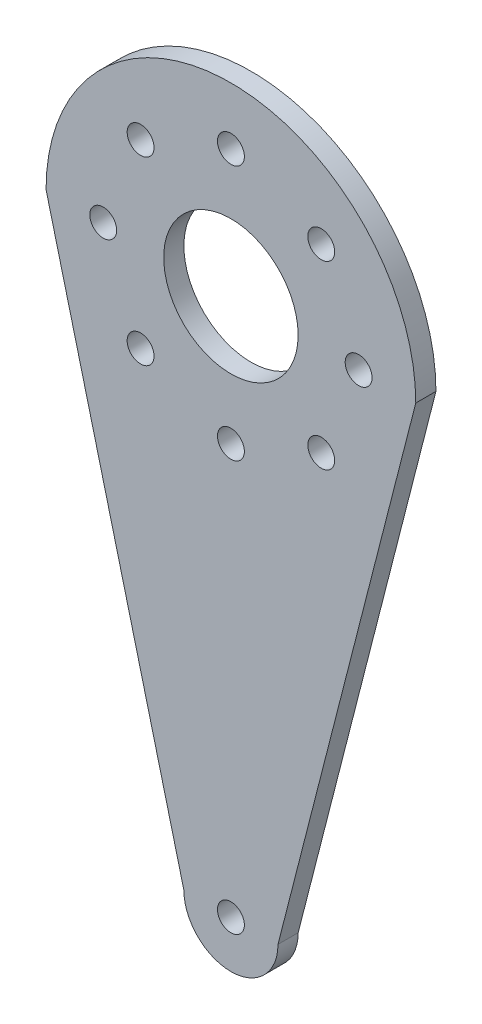
from build123d import *

# Parameters (mm, degrees)
SKETCH_1_R      = 10
SKETCH_1_R_2    = 2
EXTRUDE_1_DEPTH = 3


with BuildPart() as part:
    # 草图1 → 凸台-拉伸1 (new body)
    with BuildSketch(Plane.XY):
        with BuildLine():
            Line((242.953360513, -24.037068397), (222.453360513, 55.962931603))
            ThreePointArc((222.453360513, 55.962931603), (249.953360513, 83.462931603), (277.453360513, 55.962931603))
            Line((277.453360513, 55.962931603), (256.953360513, -24.037068397))
            ThreePointArc((256.953360513, -24.037068397), (249.953360513, -31.037068397), (242.953360513, -24.037068397))
        make_face()
        with Locations((249.953360513, 55.962931603)):
            Circle(SKETCH_1_R, mode=Mode.SUBTRACT)
        with Locations((230.953360513, 55.962931603)):
            Circle(SKETCH_1_R_2, mode=Mode.SUBTRACT)
        with Locations((236.518331671, 69.397960445)):
            Circle(SKETCH_1_R_2, mode=Mode.SUBTRACT)
        with Locations((249.953360513, 74.962931603)):
            Circle(SKETCH_1_R_2, mode=Mode.SUBTRACT)
        with Locations((263.388389356, 69.397960445)):
            Circle(SKETCH_1_R_2, mode=Mode.SUBTRACT)
        with Locations((268.953360513, 55.962931603)):
            Circle(SKETCH_1_R_2, mode=Mode.SUBTRACT)
        with Locations((263.388389356, 42.52790276)):
            Circle(SKETCH_1_R_2, mode=Mode.SUBTRACT)
        with Locations((249.953360513, 36.962931603)):
            Circle(SKETCH_1_R_2, mode=Mode.SUBTRACT)
        with Locations((236.518331671, 42.52790276)):
            Circle(SKETCH_1_R_2, mode=Mode.SUBTRACT)
        with Locations((249.953360513, -24.037068397)):
            Circle(SKETCH_1_R_2, mode=Mode.SUBTRACT)
    extrude(amount=EXTRUDE_1_DEPTH)


solid = part.part
